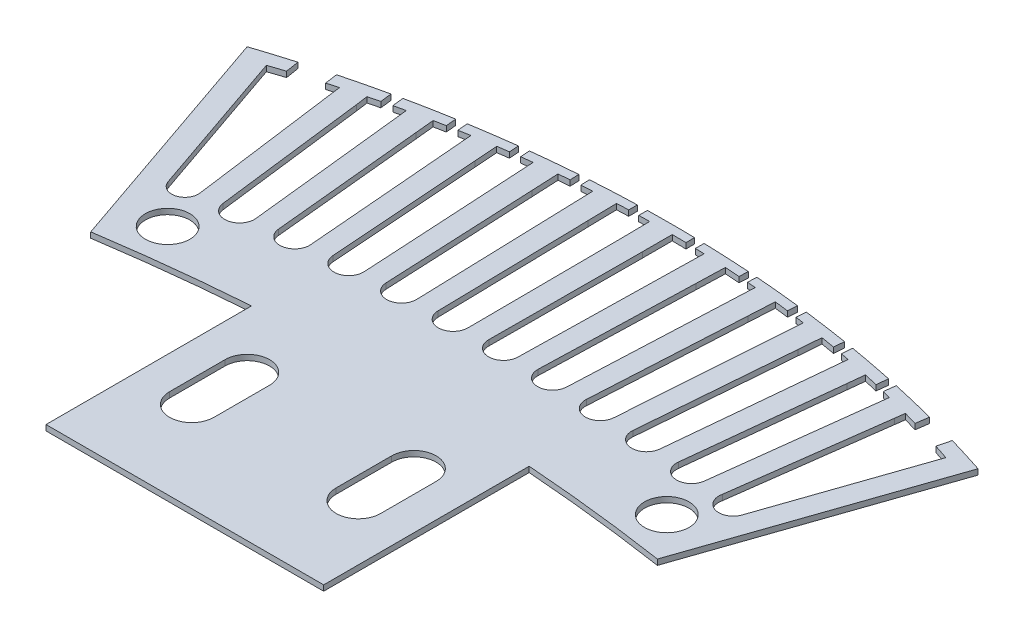
from build123d import *

# Parameters (mm, degrees)
SKETCH1_R           = 4.000000002
BOSS_EXTRUDE1_DEPTH = 0.5


with BuildPart() as part:
    # Sketch1 → Boss-Extrude1 (new, symmetric)
    with BuildSketch(Plane(origin=(0, 0, 0), x_dir=(1, 0, 0), z_dir=(0, 1, 0))):
        with BuildLine():
            Line((65.80243044, 379.334997263), (51.015920367, 336.391853867))
            ThreePointArc((51.015920367, 336.391853867), (38.036120715, 338.105541215), (25, 339.318586993))
            Line((25, 339.318586993), (25, 302.318586993))
            Line((25, 302.318586993), (-25, 302.318586993))
            Line((-25, 302.318586993), (-25, 339.318586993))
            ThreePointArc((-25, 339.318586993), (-38.036120715, 338.105541215), (-51.015920367, 336.391853867))
            Line((-51.015920367, 336.391853867), (-65.80243044, 379.334997263))
            ThreePointArc((-65.80243044, 379.334997263), (-62.322482506, 380.446647664), (-58.823769885, 381.497749102))
            Line((-58.823769885, 381.497749102), (-58.441866758, 379.078524446))
            ThreePointArc((-58.441866758, 379.078524446), (-59.8077885, 378.628639967), (-61.170247552, 378.168375279))
            Line((-61.170247552, 378.168375279), (-51.876725532, 351.178027539))
            ThreePointArc((-51.876725532, 351.178027539), (-50.835555199, 349.897393622), (-49.21359553, 349.591933766))
            ThreePointArc((-49.21359553, 349.591933766), (-47.677203739, 350.533196913), (-47.228763117, 352.278297786))
            Line((-47.228763117, 352.278297786), (-50.893852202, 379.616116075))
            Line((-50.893852202, 379.616116075), (-51.119156853, 381.296658474))
            ThreePointArc((-51.119156853, 381.296658474), (-52.095910999, 381.019413301), (-53.071161649, 380.736924864))
            Line((-53.071161649, 380.736924864), (-53.388434444, 383.013066272))
            ThreePointArc((-53.388434444, 383.013066272), (-49.443901348, 384.006456632), (-45.480913309, 384.923458032))
            Line((-45.480913309, 384.923458032), (-45.235668451, 382.847851104))
            ThreePointArc((-45.235668451, 382.847851104), (-46.232899372, 382.599148734), (-47.228763117, 382.345027153))
            Line((-47.228763117, 382.345027153), (-46.926601104, 380.126918116))
            Line((-46.926601104, 380.126918116), (-43.547211135, 352.752314715))
            ThreePointArc((-43.547211135, 352.752314715), (-40.584981699, 350.405047421), (-38.237714405, 353.367276857))
            Line((-38.237714405, 353.367276857), (-41.205072016, 380.789603083))
            Line((-41.205072016, 380.789603083), (-41.52255618, 383.723503438))
            ThreePointArc((-41.52255618, 383.723503438), (-42.512139772, 383.497857545), (-43.500497315, 383.266900581))
            Line((-43.500497315, 383.266900581), (-43.731557591, 385.30268778))
            ThreePointArc((-43.731557591, 385.30268778), (-39.743092995, 386.109380282), (-35.739783135, 386.838840899))
            Line((-35.739783135, 386.838840899), (-35.566604897, 384.96440118))
            ThreePointArc((-35.566604897, 384.96440118), (-36.561570682, 384.770992092), (-37.555484927, 384.572249894))
            Line((-37.555484927, 384.572249894), (-37.22609411, 381.199157508))
            Line((-37.22609411, 381.199157508), (-34.545280114, 353.747337455))
            ThreePointArc((-34.545280114, 353.747337455), (-31.643818487, 351.325357396), (-29.221838428, 354.226819023))
            Line((-29.221838428, 354.226819023), (-31.489537897, 381.715848216))
            Line((-31.489537897, 381.715848216), (-31.813626132, 385.644311171))
            ThreePointArc((-31.813626132, 385.644311171), (-32.813358152, 385.470831192), (-33.812144417, 385.291986535))
            Line((-33.812144417, 385.291986535), (-33.973906936, 387.135282888))
            ThreePointArc((-33.973906936, 387.135282888), (-29.95067499, 387.753224959), (-25.916249031, 388.293275776))
            Line((-25.916249031, 388.293275776), (-25.801341751, 386.571663827))
            ThreePointArc((-25.801341751, 386.571663827), (-26.805104169, 386.430596398), (-27.808095595, 386.284147736))
            Line((-27.808095595, 386.284147736), (-27.501416684, 382.023889106))
            Line((-27.501416684, 382.023889106), (-25.52091928, 354.512676521))
            ThreePointArc((-25.52091928, 354.512676521), (-22.682109343, 352.017556258), (-20.18698908, 354.856366194))
            Line((-20.18698908, 354.856366194), (-21.75355802, 382.394250074))
            Line((-21.75355802, 382.394250074), (-22.018659538, 387.05410403))
            ThreePointArc((-22.018659538, 387.05410403), (-23.025832296, 386.933222172), (-24.032341752, 386.806936377))
            Line((-24.032341752, 386.806936377), (-24.137915449, 388.50617313))
            ThreePointArc((-24.137915449, 388.50617313), (-20.089178094, 388.933793615), (-16.032929324, 389.283049057))
            Line((-16.032929324, 389.283049057), (-15.966308262, 387.665475024))
            ThreePointArc((-15.966308262, 387.665475024), (-16.976153588, 387.577131196), (-17.985510559, 387.483372348))
            Line((-17.985510559, 387.483372348), (-17.758882936, 382.600577423))
            Line((-17.758882936, 382.600577423), (-16.479988035, 355.047834987))
            ThreePointArc((-16.479988035, 355.047834987), (-13.705672993, 352.48119457), (-11.139032576, 355.255509612))
            Line((-11.139032576, 355.255509612), (-12.003453832, 382.82436818))
            Line((-12.003453832, 382.82436818), (-12.15955094, 387.949526478))
            ThreePointArc((-12.15955094, 387.949526478), (-13.173743288, 387.881402609), (-14.187554586, 387.807825226))
            Line((-14.187554586, 387.807825226), (-14.246236497, 389.411858109))
            ThreePointArc((-14.246236497, 389.411858109), (-10.127661475, 389.650662833), (-6.005198122, 389.80872549))
            Line((-6.005198122, 389.80872549), (-6.005198122, 388.245654742))
            ThreePointArc((-6.005198122, 388.245654742), (-7.05985898, 388.209179885), (-8.114299739, 388.166816865))
            Line((-8.114299739, 388.166816865), (-8.004818569, 382.928848021))
            Line((-8.004818569, 382.928848021), (-7.428356542, 355.352465383))
            ThreePointArc((-7.428356542, 355.352465383), (-4.720337723, 352.715971299), (-2.083843639, 355.423990119))
            Line((-2.083843639, 355.423990119), (-2.245555953, 383.005923263))
            Line((-2.245555953, 383.005923263), (-2.310612932, 388.326957333))
            ThreePointArc((-2.310612932, 388.326957333), (-3.278261595, 388.312648666), (-4.245824307, 388.293385462))
            Line((-4.245824307, 388.293385462), (-4.245824307, 389.851568653))
            ThreePointArc((-4.245824307, 389.851568653), (0, 389.894383016), (4.245824307, 389.851568653))
            Line((4.245824307, 389.851568653), (4.245824307, 388.293385462))
            ThreePointArc((4.245824307, 388.293385462), (3.000198949, 388.317267838), (1.754443225, 388.332938799))
            Line((1.754443225, 388.332938799), (1.754443225, 383.00848776))
            Line((1.754443225, 383.00848776), (1.628098088, 355.426369915))
            ThreePointArc((1.628098088, 355.426369915), (4.268062404, 352.721734007), (6.972698312, 355.361698322))
            Line((6.972698312, 355.361698322), (7.513799937, 382.938797442))
            Line((7.513799937, 382.938797442), (7.61677331, 388.187540192))
            ThreePointArc((7.61677331, 388.187540192), (6.811047698, 388.2183163), (6.005198122, 388.245654742))
            Line((6.005198122, 388.245654742), (6.005198122, 389.80872549))
            ThreePointArc((6.005198122, 389.80872549), (10.200360119, 389.647149257), (14.391466477, 389.4019584))
            Line((14.391466477, 389.4019584), (14.297595761, 387.799509147))
            ThreePointArc((14.297595761, 387.799509147), (12.982705245, 387.894653623), (11.667183063, 387.980624108))
            Line((11.667183063, 387.980624108), (11.512565881, 382.83944493))
            Line((11.512565881, 382.83944493), (10.683495615, 355.269500599))
            ThreePointArc((10.683495615, 355.269500599), (13.253691331, 352.498478952), (16.024712977, 355.068674668))
            Line((16.024712977, 355.068674668), (17.268277211, 382.623034301))
            Line((17.268277211, 382.623034301), (17.489726394, 387.530107924))
            ThreePointArc((17.489726394, 387.530107924), (16.728155334, 387.599332355), (15.96631042, 387.665474841))
            Line((15.96631042, 387.665474841), (16.032929324, 389.283049057))
            ThreePointArc((16.032929324, 389.283049057), (20.089178094, 388.933793615), (24.137915449, 388.50617313))
            Line((24.137915449, 388.50617313), (24.032345164, 386.80693594))
            ThreePointArc((24.032345164, 386.80693594), (22.778670165, 386.96339462), (21.523977308, 387.111469464))
            Line((21.523977308, 387.111469464), (21.263213574, 382.421829288))
            Line((21.263213574, 382.421829288), (19.731956484, 354.881959288))
            ThreePointArc((19.731956484, 354.881959288), (22.230714804, 352.046351092), (25.066323, 354.545109412))
            Line((25.066323, 354.545109412), (27.011542412, 382.058838862))
            Line((27.011542412, 382.058838862), (27.315394441, 386.35677448))
            ThreePointArc((27.315394441, 386.35677448), (26.558587289, 386.465750199), (25.801345462, 386.571663315))
            Line((25.801345462, 386.571663315), (25.916249031, 388.293275776))
            ThreePointArc((25.916249031, 388.293275776), (29.95067499, 387.753224959), (33.973906936, 387.135282888))
            Line((33.973906936, 387.135282888), (33.812149624, 385.291985588))
            ThreePointArc((33.812149624, 385.291985588), (32.568090033, 385.513903644), (31.322574463, 385.727498716))
            Line((31.322574463, 385.727498716), (31.000055331, 381.755911987))
            Line((31.000055331, 381.755911987), (28.767605642, 354.263997606))
            ThreePointArc((28.767605642, 354.263997606), (31.193304154, 351.365643986), (34.091657775, 353.791342498))
            Line((34.091657775, 353.791342498), (36.737269359, 381.246577448))
            Line((36.737269359, 381.246577448), (37.067199889, 384.670579651))
            ThreePointArc((37.067199889, 384.670579651), (36.317202319, 384.819007433), (35.566610466, 384.964400113))
            Line((35.566610466, 384.964400113), (35.739783135, 386.838840899))
            ThreePointArc((35.739783135, 386.838840899), (39.743092995, 386.109380282), (43.731557591, 385.30268778))
            Line((43.731557591, 385.30268778), (43.500504712, 383.266898831))
            ThreePointArc((43.500504712, 383.266898831), (42.269429763, 383.553718143), (41.036464089, 383.83229757))
            Line((41.036464089, 383.83229757), (40.716769144, 380.842125398))
            Line((40.716769144, 380.842125398), (37.784576358, 353.41601679))
            ThreePointArc((37.784576358, 353.41601679), (40.135640087, 350.456799609), (43.094857268, 352.807863338))
            Line((43.094857268, 352.807863338), (46.439143262, 380.186777452))
            Line((46.439143262, 380.186777452), (46.718748182, 382.475891841))
            ThreePointArc((46.718748182, 382.475891841), (45.97758838, 382.663370263), (45.235676294, 382.847849171))
            Line((45.235676294, 382.847849171), (45.480913309, 384.923458032))
            ThreePointArc((45.480913309, 384.923458032), (49.443901348, 384.006456632), (53.388434444, 383.013066272))
            Line((53.388434444, 383.013066272), (53.071171737, 380.736921913))
            ThreePointArc((53.071171737, 380.736921913), (51.856755744, 381.087820322), (50.640020003, 381.430588511))
            Line((50.640020003, 381.430588511), (50.407046074, 379.681062832))
            Line((50.407046074, 379.681062832), (46.777014026, 352.338567422))
            ThreePointArc((46.777014026, 352.338567422), (48.746599838, 349.208441728), (51.876725533, 351.178027539))
            Line((51.876725533, 351.178027539), (61.170247552, 378.168375279))
            ThreePointArc((61.170247552, 378.168375279), (59.832188802, 378.620498527), (58.490788762, 379.062610029))
            Line((58.490788762, 379.062610029), (59.094809365, 381.418682048))
            ThreePointArc((59.094809365, 381.418682048), (62.457309927, 380.404813844), (65.80243044, 379.334997263))
        make_face()
        with Locations(Location((-44.941035951, 344.159509187, 0), (0, 0, 270))):
            Circle(SKETCH1_R, mode=Mode.SUBTRACT)
        with Locations(Location((44.941035951, 344.159509187, 0), (0, 0, 90))):
            Circle(SKETCH1_R, mode=Mode.SUBTRACT)
        with BuildLine():
            Line((-19, 328.568586993), (-19, 318.568586993))
            ThreePointArc((-19, 318.568586993), (-15, 314.568586993), (-11, 318.568586993))
            Line((-11, 318.568586993), (-11, 328.568586993))
            ThreePointArc((-11, 328.568586993), (-15, 332.568586993), (-19, 328.568586993))
        make_face(mode=Mode.SUBTRACT)
        with BuildLine():
            Line((19.000000001, 328.568586993), (19.000000001, 318.568586993))
            ThreePointArc((19.000000001, 318.568586993), (15, 314.568586993), (11.000000001, 318.568586993))
            Line((11.000000001, 318.568586993), (11.000000001, 328.568586993))
            ThreePointArc((11.000000001, 328.568586993), (15.000000001, 332.568586993), (19.000000001, 328.568586993))
        make_face(mode=Mode.SUBTRACT)
    extrude(amount=BOSS_EXTRUDE1_DEPTH, both=True)


solid = part.part
